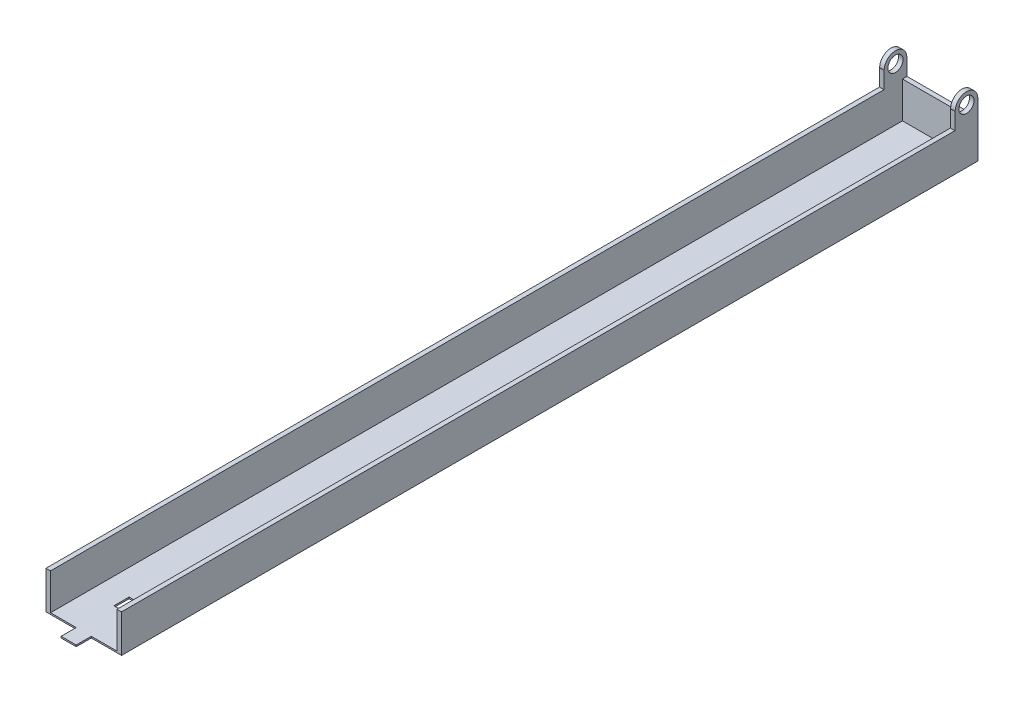
from build123d import *

# Parameters (mm, degrees)
SKETCH1_W           = 12.7
SKETCH1_H           = 6.35
BOSS_EXTRUDE1_DEPTH = 144.78
CUT_EXTRUDE1_DEPTH  = 6.096
SKETCH3_R           = 1.27
BOSS_EXTRUDE2_DEPTH = 0.762
SKETCH5_W           = 12.7
SKETCH5_H           = 6.35
CUT_EXTRUDE2_DEPTH  = 0.762
SKETCH6_W           = 2.54
SKETCH6_H           = 0.254
BOSS_EXTRUDE3_DEPTH = 2.54
SKETCH8_W           = 2.54
SKETCH8_H           = 2.54
CUT_EXTRUDE3_DEPTH  = 2.54


with BuildPart() as part:
    # Sketch1 → Boss-Extrude1 (new body)
    with BuildSketch(Plane.XY):
        Rectangle(SKETCH1_W, SKETCH1_H)
    extrude(amount=-BOSS_EXTRUDE1_DEPTH)

    # Sketch2 → Cut-Extrude1 (cut)
    with BuildSketch(Plane(origin=(0, 3.175, 0), x_dir=(1, 0, 0), z_dir=(0, 1, 0))):
        Polygon((5.588, 0.381), (-5.588, 0.381), (-5.588, 0.762), (-5.588, 144.018), (5.588, 144.018), (5.588, 0.762), align=None)
    extrude(amount=-CUT_EXTRUDE1_DEPTH, mode=Mode.SUBTRACT)

    # Sketch3 → Boss-Extrude2 (add)
    with BuildSketch(Plane(origin=(6.35, 0, 0), x_dir=(0, 0, -1), z_dir=(1, 0, 0))):
        with BuildLine():
            Line((144.78, 3.175), (144.78, 5.979528965))
            Line((144.78, 5.979528965), (144.749123731, 5.979528965))
            ThreePointArc((144.749123731, 5.979528965), (142.844123731, 7.884528965), (140.939123731, 5.979528965))
            Line((140.939123731, 5.979528965), (140.908247462, 5.979528965))
            Line((140.908247462, 5.979528965), (140.908247462, 3.175))
            Line((140.908247462, 3.175), (144.78, 3.175))
        make_face()
        with Locations((142.844123731, 5.979528965)):
            Circle(SKETCH3_R, mode=Mode.SUBTRACT)
    boss_extrude2 = extrude(amount=-BOSS_EXTRUDE2_DEPTH)

    # Mirror1: Boss-Extrude2 across plane
    add(boss_extrude2.mirror(Plane(origin=(0, 0, 0), x_dir=(0, 0, 1), z_dir=(1, 0, 0))))

    # Sketch5 → Cut-Extrude2 (cut)
    with BuildSketch(Plane.XY):
        Rectangle(SKETCH5_W, SKETCH5_H)
    extrude(amount=-CUT_EXTRUDE2_DEPTH, mode=Mode.SUBTRACT)

    # Sketch6 → Boss-Extrude3 (add)
    with BuildSketch(Plane.XY.offset(-0.762)):
        with Locations((0, -3.048)):
            Rectangle(SKETCH6_W, SKETCH6_H)
    extrude(amount=BOSS_EXTRUDE3_DEPTH)

    # Sketch8 → Cut-Extrude3 (cut)
    with BuildSketch(Plane(origin=(0, -2.921, 0), x_dir=(1, 0, 0), z_dir=(0, 1, 0))):
        with Locations((0, 8.382)):
            Rectangle(SKETCH8_W, SKETCH8_H)
    extrude(amount=-CUT_EXTRUDE3_DEPTH, mode=Mode.SUBTRACT)


solid = part.part
